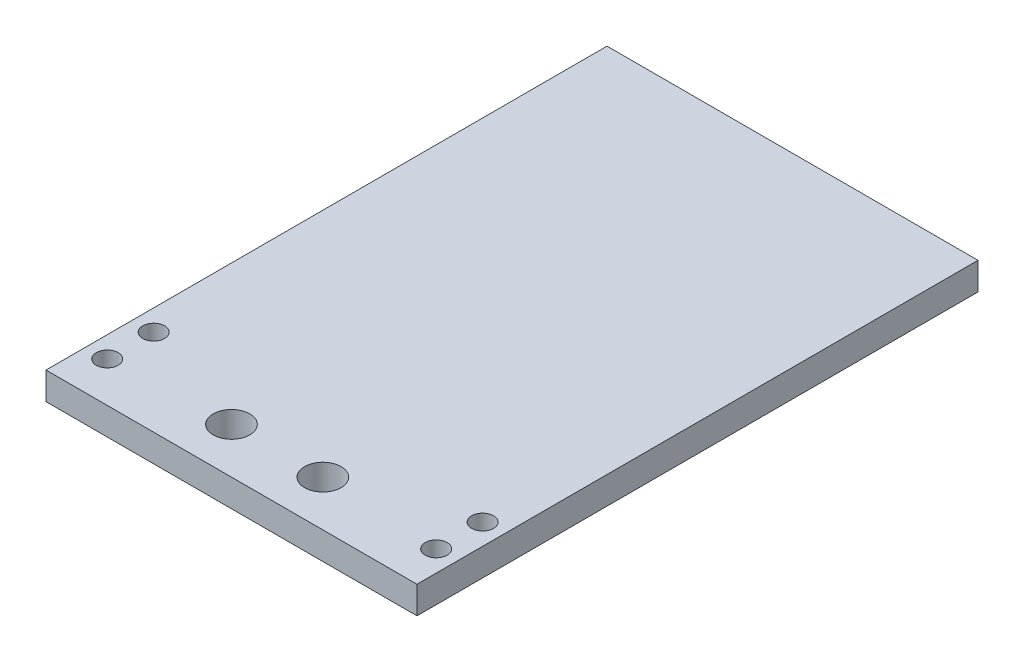
from build123d import *

# Parameters (mm, degrees)
SKETCH_2_W      = 20.3
SKETCH_2_H      = 30.7
SKETCH_2_R      = 0.6
SKETCH_2_R_2    = 1
EXTRUDE_1_DEPTH = 1.5


with BuildPart() as part:
    # Эскиз2 → Бобышка-Вытянуть1 (new body)
    with BuildSketch(Plane(origin=(0, 0, 0), x_dir=(1, 0, 0), z_dir=(0, 1, 0))):
        Rectangle(SKETCH_2_W, SKETCH_2_H)
        with Locations(Location((-9, -13.15, 0), (0, 0, 270))):
            Circle(SKETCH_2_R, mode=Mode.SUBTRACT)
        with Locations(Location((-9, -10.61, 0), (0, 0, 270))):
            Circle(SKETCH_2_R, mode=Mode.SUBTRACT)
        with Locations(Location((9, -13.15, 0), (0, 0, 90))):
            Circle(SKETCH_2_R, mode=Mode.SUBTRACT)
        with Locations(Location((9, -10.61, 0), (0, 0, 90))):
            Circle(SKETCH_2_R, mode=Mode.SUBTRACT)
        with Locations(Location((-2.5, -12.85, 0), (0, 0, 270))):
            Circle(SKETCH_2_R_2, mode=Mode.SUBTRACT)
        with Locations(Location((2.5, -12.85, 0), (0, 0, 90))):
            Circle(SKETCH_2_R_2, mode=Mode.SUBTRACT)
    extrude(amount=EXTRUDE_1_DEPTH)


solid = part.part
